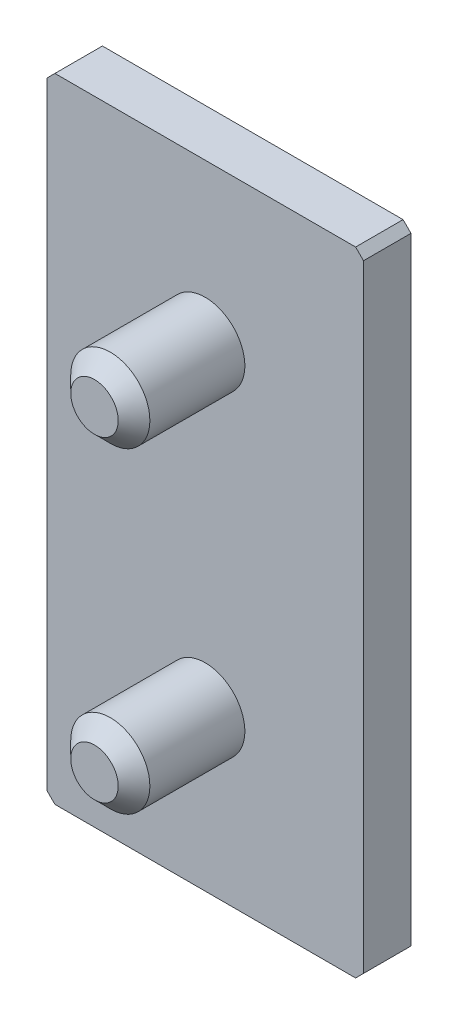
from build123d import *

# Parameters (mm, degrees)
SKETCH1_W           = 20
SKETCH1_H           = 40
BOSS_EXTRUDE1_DEPTH = 3
SKETCH2_R           = 2.5
BOSS_EXTRUDE2_DEPTH = 7
CHAMFER1_SIZE       = 1
CHAMFER2_SIZE       = 0.5


with BuildPart() as part:
    # Sketch1 → Boss-Extrude1 (new body)
    with BuildSketch(Plane.XY):
        with Locations((10, 20)):
            Rectangle(SKETCH1_W, SKETCH1_H)
    extrude(amount=BOSS_EXTRUDE1_DEPTH)

    # Sketch2 → Boss-Extrude2 (add)
    with BuildSketch(Plane.XY.offset(3)):
        with Locations(Location((10, 30, 0), (0, 0, 180))):
            Circle(SKETCH2_R)
        with Locations(Location((10, 10, 0), (0, 0, 180))):
            Circle(SKETCH2_R)
    extrude(amount=BOSS_EXTRUDE2_DEPTH)

    # Chamfer1
    chamfer1_edges = [part.edges().sort_by_distance(p)[0] for p in [
        (12.5, 30, 10),
        (12.5, 10, 10),
    ]]
    chamfer(chamfer1_edges, length=CHAMFER1_SIZE)

    # Chamfer2
    chamfer2_edges = [part.edges().sort_by_distance(p)[0] for p in [
        (0, 40, 1.5),
        (20, 40, 1.5),
        (20, 0, 1.5),
        (0, 0, 1.5),
    ]]
    chamfer(chamfer2_edges, length=CHAMFER2_SIZE)


solid = part.part
